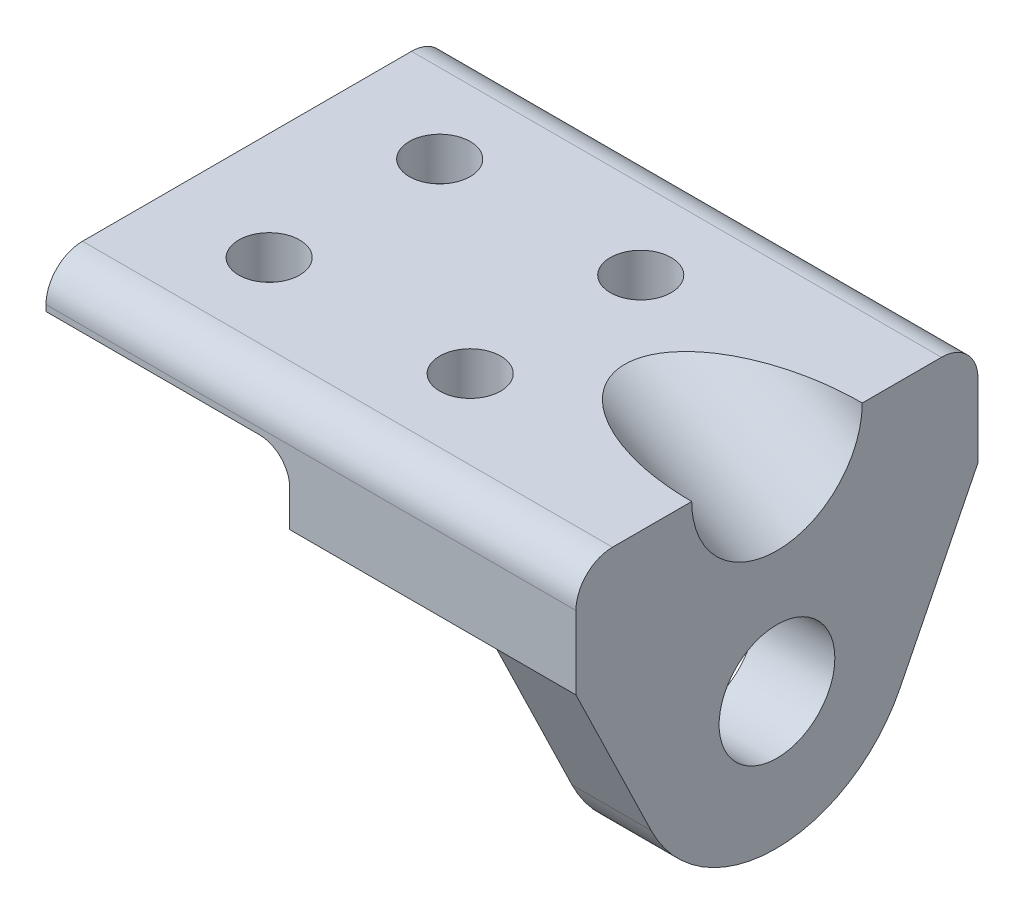
from build123d import *

# Parameters (mm, degrees)
SKETCH1_W           = 87
SKETCH1_H           = 7
BOSS_EXTRUDE1_DEPTH = 66
FILLET1_R           = 6
SKETCH2_R           = 5
CUT_EXTRUDE1_DEPTH  = 111.675200474
SKETCH3_R           = 9.5
BOSS_EXTRUDE2_DEPTH = 13
SKETCH9_R           = 14


with BuildPart() as part:
    # Sketch1 → Boss-Extrude1 (new body)
    with BuildSketch(Plane.XY):
        with Locations((43.5, 3.5)):
            Rectangle(SKETCH1_W, SKETCH1_H)
        with BuildLine():
            ThreePointArc((35, 0), (38.535533906, -1.464466094), (40, -5))
            Line((40, -5), (40, -11))
            Line((40, -11), (87, -11))
            Line((87, -11), (87, 0))
            Line((87, 0), (35, 0))
        make_face()
    extrude(amount=BOSS_EXTRUDE1_DEPTH)

    # Fillet1
    fillet1_edges = [part.edges().sort_by_distance(p)[0] for p in [
        (43.5, 7, 66),
        (43.5, 7, 0),
    ]]
    fillet(fillet1_edges, radius=FILLET1_R)

    # Sketch2 → Cut-Extrude1 (cut, through all)
    with BuildSketch(Plane(origin=(0, 7, 0), x_dir=(1, 0, 0), z_dir=(0, 1, 0))):
        with Locations(Location((50.635865221, -47, 0), (0, 0, 270))):
            Circle(SKETCH2_R)
        with Locations(Location((17.635865221, -47, 0), (0, 0, 270))):
            Circle(SKETCH2_R)
        with Locations(Location((50.635865221, -19, 0), (0, 0, 90))):
            Circle(SKETCH2_R)
        with Locations(Location((17.635865221, -19, 0), (0, 0, 270))):
            Circle(SKETCH2_R)
    extrude(amount=-CUT_EXTRUDE1_DEPTH, mode=Mode.SUBTRACT)

    # Sketch3 → Boss-Extrude2 (add)
    with BuildSketch(Plane(origin=(87, 0, 0), x_dir=(0, 0, -1), z_dir=(1, 0, 0))):
        with BuildLine():
            Line((0, -11), (-66, -11))
            Line((-66, -11), (-53.656311688, -36.45938769))
            ThreePointArc((-53.656311688, -36.45938769), (-33.320230855, -49.283211846), (-12.834921269, -36.699144903))
            Line((-12.834921269, -36.699144903), (0, -11))
        make_face()
        with Locations((-33, -27)):
            Circle(SKETCH3_R, mode=Mode.SUBTRACT)
    extrude(amount=-BOSS_EXTRUDE2_DEPTH)

    # Cut-Sweep4: sweep along a path in Sketch8
    with BuildLine(Plane.XY.offset(33)) as cut_sweep4_path:
        Line((87, -7), (62, 7))
    # Sketch9 → Cut-Sweep4 (sweep, cut)
    with BuildSketch(Plane(origin=(87, 0, 0), x_dir=(0, 0, -1), z_dir=(1, 0, 0))):
        with Locations((-33, 7)):
            Circle(SKETCH9_R)
    sweep(path=cut_sweep4_path.line, mode=Mode.SUBTRACT)


solid = part.part
